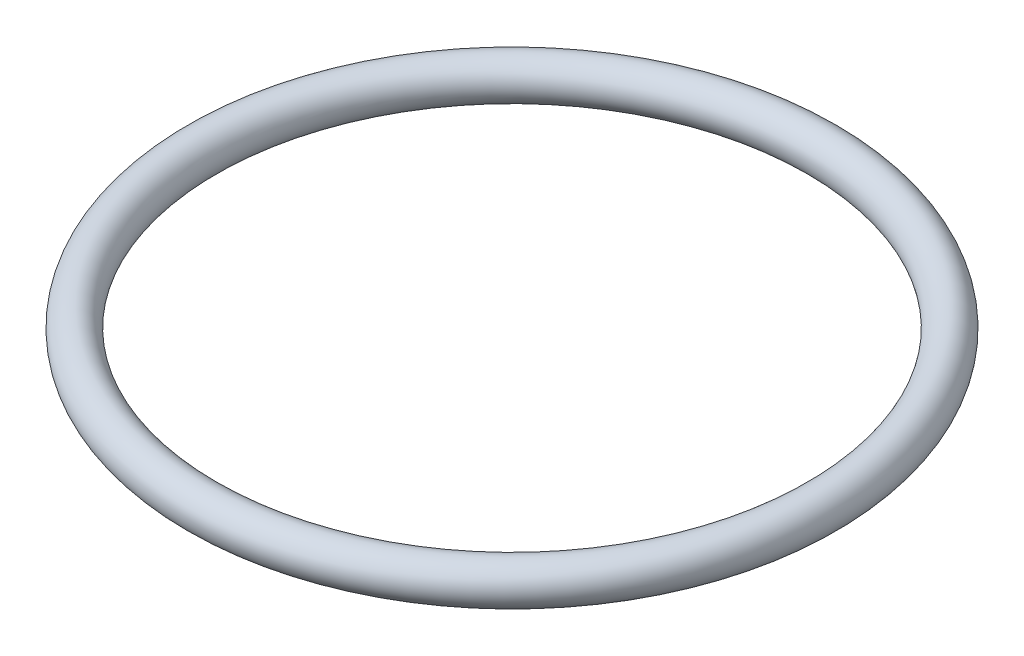
from build123d import *

# Parameters (mm, degrees)
SKETCH2_R = 1.3081


with BuildPart() as part:
    # Sweep1: sweep along a path in Sketch1
    with BuildLine(Plane(origin=(0, 0, 0), x_dir=(1, 0, 0), z_dir=(0, 1, 0))) as sweep1_path:
        CenterArc((0, 0), 18.8849, 0, 360)
    # Sketch2 → Sweep1 (sweep)
    with BuildSketch(Plane.XY):
        with Locations((-20.193, 0)):
            Circle(SKETCH2_R)
    sweep(path=sweep1_path.line)


solid = part.part
